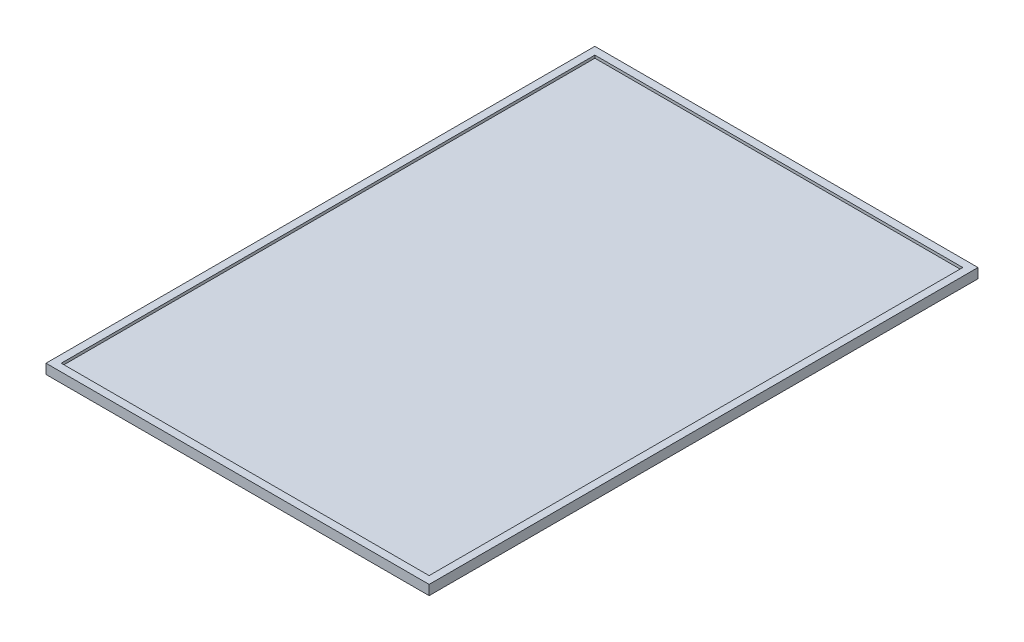
from build123d import *

# Parameters (mm, degrees)
SKETCH1_W           = 705
SKETCH1_H           = 1010
BOSS_EXTRUDE1_DEPTH = 18
SKETCH2_W           = 677
SKETCH2_H           = 982
CUT_EXTRUDE1_DEPTH  = 5
SKETCH4_W           = 676
SKETCH4_H           = 981
CUT_EXTRUDE2_DEPTH  = 6


with BuildPart() as part:
    # Sketch1 → Boss-Extrude1 (new body)
    with BuildSketch(Plane(origin=(0, 0, 0), x_dir=(1, 0, 0), z_dir=(0, 1, 0))):
        Rectangle(SKETCH1_W, SKETCH1_H)
    extrude(amount=BOSS_EXTRUDE1_DEPTH)

    # Sketch2 → Cut-Extrude1 (cut)
    with BuildSketch(Plane(origin=(0, 18, 0), x_dir=(1, 0, 0), z_dir=(0, 1, 0))):
        Rectangle(SKETCH2_W, SKETCH2_H)
    extrude(amount=-CUT_EXTRUDE1_DEPTH, mode=Mode.SUBTRACT)

    # Sketch4 → Cut-Extrude2 (cut)
    with BuildSketch(Plane.XZ):
        Rectangle(SKETCH4_W, SKETCH4_H)
    extrude(amount=-CUT_EXTRUDE2_DEPTH, mode=Mode.SUBTRACT)


solid = part.part
